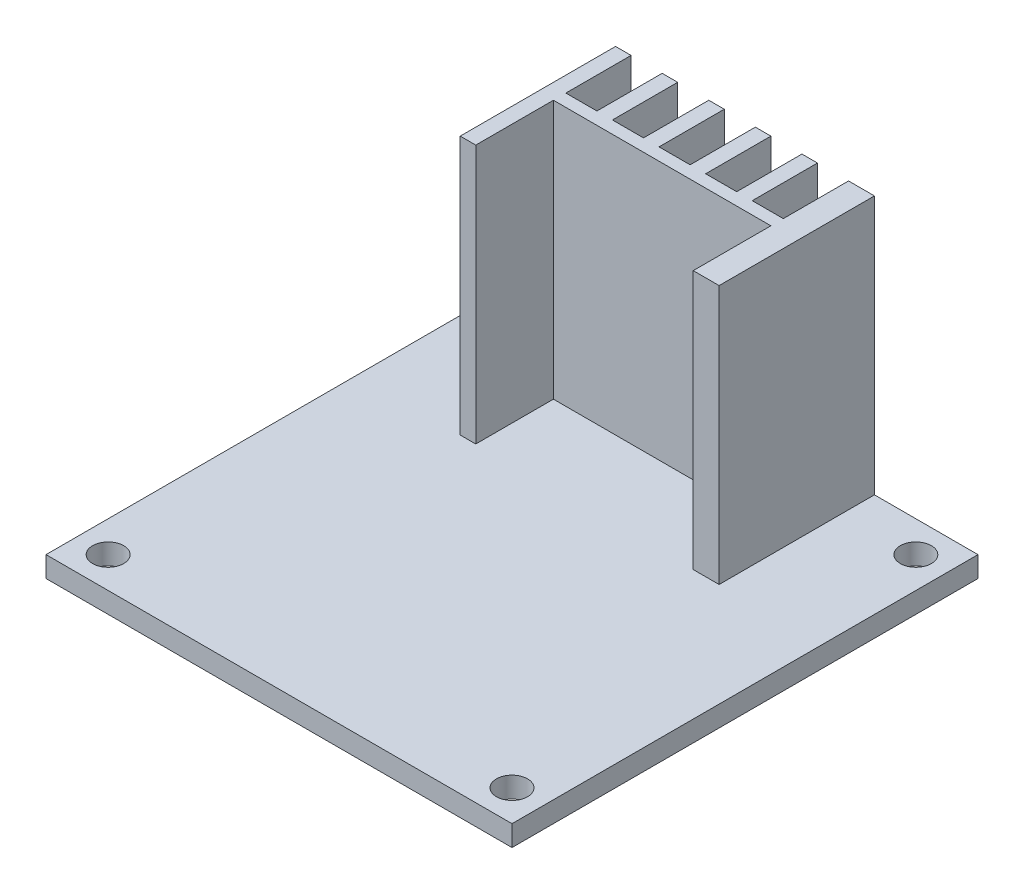
from build123d import *

# Parameters (mm, degrees)
SKETCH1_W           = 45
SKETCH1_H           = 45
SKETCH1_R           = 1.5
BOSS_EXTRUDE1_DEPTH = 2
BOSS_EXTRUDE2_DEPTH = 25


with BuildPart() as part:
    # Sketch1 → Boss-Extrude1 (new body)
    with BuildSketch(Plane(origin=(0, 0, 0), x_dir=(1, 0, 0), z_dir=(0, 1, 0))):
        Rectangle(SKETCH1_W, SKETCH1_H)
        with Locations(Location((-19.5, 19.5, 0), (0, 0, 270))):
            Circle(SKETCH1_R, mode=Mode.SUBTRACT)
        with Locations(Location((19.5, 19.5, 0), (0, 0, 270))):
            Circle(SKETCH1_R, mode=Mode.SUBTRACT)
        with Locations(Location((-19.5, -19.5, 0), (0, 0, 270))):
            Circle(SKETCH1_R, mode=Mode.SUBTRACT)
        with Locations(Location((19.5, -19.5, 0), (0, 0, 270))):
            Circle(SKETCH1_R, mode=Mode.SUBTRACT)
    extrude(amount=BOSS_EXTRUDE1_DEPTH)

    # Sketch2 → Boss-Extrude2 (add)
    with BuildSketch(Plane(origin=(0, 2, 0), x_dir=(1, 0, 0), z_dir=(0, 1, 0))):
        Polygon((10, 7.5), (12.5, 7.5), (12.5, 22.5), (10, 22.5), (10, 16.2), (7, 16.2), (7, 22.5), (5.5, 22.5), (5.5, 16.2), (2.5, 16.2), (2.5, 22.5), (1, 22.5), (1, 16.2), (-2, 16.2), (-2, 22.5), (-3.5, 22.5), (-3.5, 16.2), (-6.5, 16.2), (-6.5, 22.5), (-8, 22.5), (-8, 16.2), (-11, 16.2), (-11, 22.5), (-12.5, 22.5), (-12.5, 7.5), (-11, 7.5), (-11, 15), (10, 15), align=None)
    extrude(amount=BOSS_EXTRUDE2_DEPTH)


solid = part.part
